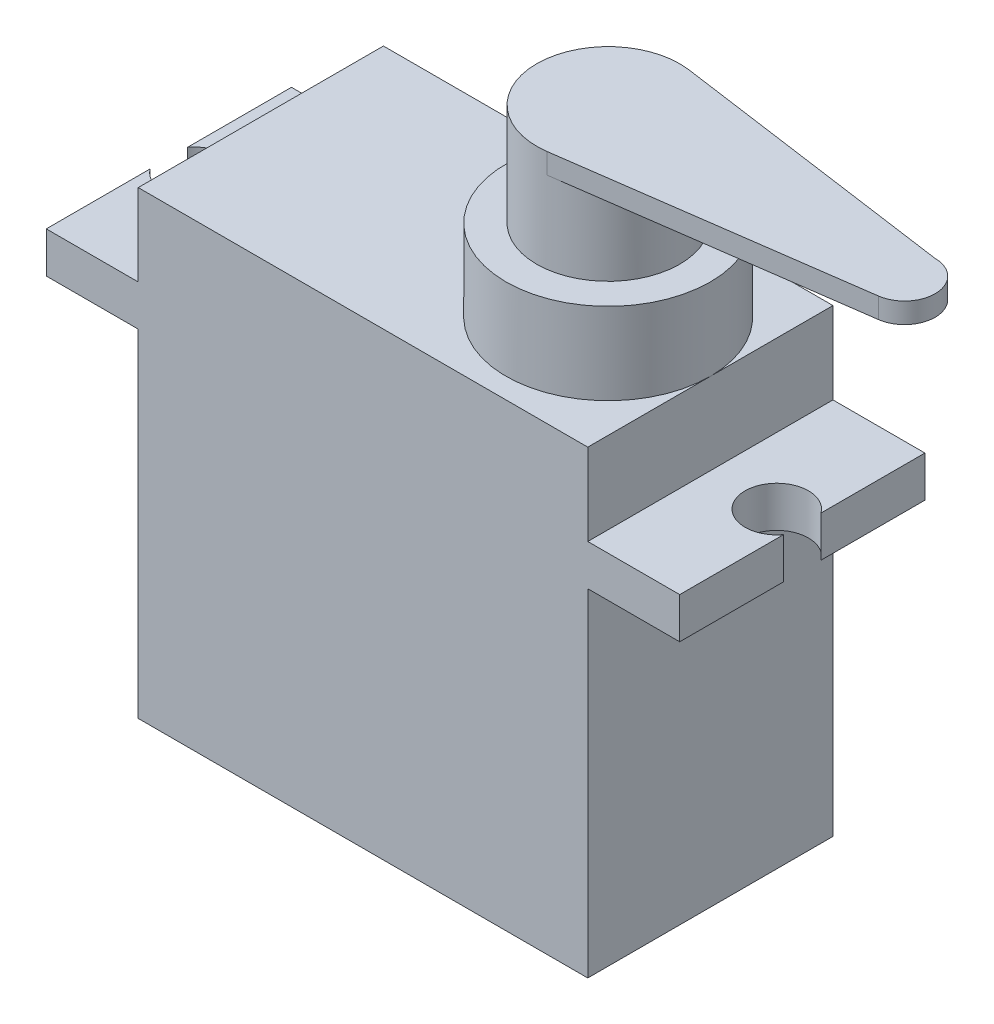
from build123d import *
from build123d.topology import SkipClean

# Parameters (mm, degrees)
SKETCH1_W           = 22
SKETCH1_H           = 12
BOSS_EXTRUDE1_DEPTH = 16.5
BOSS_EXTRUDE2_DEPTH = 2
SKETCH4_W           = 22
SKETCH4_H           = 12
BOSS_EXTRUDE3_DEPTH = 4
SKETCH5_R           = 5
BOSS_EXTRUDE4_DEPTH = 4
SKETCH7_R           = 3.5
BOSS_EXTRUDE5_DEPTH = 4
BOSS_EXTRUDE6_DEPTH = 1
CUT_EXTRUDE2_REACH  = 40.888


with BuildPart() as part:
    # Sketch1 → Boss-Extrude1 (new body)
    with BuildSketch(Plane(origin=(0, 0, 0), x_dir=(1, 0, 0), z_dir=(0, 1, 0))):
        Rectangle(SKETCH1_W, SKETCH1_H)
    extrude(amount=BOSS_EXTRUDE1_DEPTH)

    # Sketch2 → Boss-Extrude2 (add)
    with BuildSketch(Plane(origin=(0, 16.5, 0), x_dir=(1, 0, 0), z_dir=(0, 1, 0))):
        with BuildLine():
            Line((-15.5, 6), (15.5, 6))
            Line((15.5, 6), (15.5, 0.916515))
            ThreePointArc((15.5, 0.916515), (12.7, 0), (15.5, -0.916515))
            Line((15.5, -0.916515), (15.5, -6))
            Line((15.5, -6), (-15.5, -6))
            Line((-15.5, -6), (-15.5, -0.916515))
            ThreePointArc((-15.5, -0.916515), (-12.7, 0), (-15.5, 0.916515))
            Line((-15.5, 0.916515), (-15.5, 6))
        make_face()
    extrude(amount=BOSS_EXTRUDE2_DEPTH)

    # Sketch4 → Boss-Extrude3 (add)
    with BuildSketch(Plane(origin=(0, 18.5, 0), x_dir=(1, 0, 0), z_dir=(0, 1, 0))):
        Rectangle(SKETCH4_W, SKETCH4_H)
    extrude(amount=BOSS_EXTRUDE3_DEPTH)

    # Sketch5 → Boss-Extrude4 (add)
    with BuildSketch(Plane(origin=(0, 22.5, 0), x_dir=(1, 0, 0), z_dir=(0, 1, 0))):
        with Locations((6, 0)):
            Circle(SKETCH5_R)
    extrude(amount=BOSS_EXTRUDE4_DEPTH)

    # Sketch7 → Boss-Extrude5 (add)
    with BuildSketch(Plane(origin=(0, 26.5, 0), x_dir=(1, 0, 0), z_dir=(0, 1, 0))):
        with Locations(Location((6, 0, 0), (0, 0, 270))):
            Circle(SKETCH7_R)
    extrude(amount=BOSS_EXTRUDE5_DEPTH)

    # Sketch8 → Boss-Extrude6 (add)
    with SkipClean():  # the faces are left unmerged after this step: merging them gives an invalid solid
        with BuildSketch(Plane(origin=(0, 30.5, 0), x_dir=(1, 0, 0), z_dir=(0, 1, 0))):
            with BuildLine():
                Line((5.516407, -3.46643), (-8.710709, -1.481642))
                ThreePointArc((-8.710709, -1.481642), (-9.996409, 0.103599), (-8.504009, 1.495991))
                Line((-8.504009, 1.495991), (5.512894, 3.465938))
                ThreePointArc((5.512894, 3.465938), (6, 3.5), (6.487106, 3.465938))
                Line((6.487106, 3.465938), (20.504009, 1.495991))
                ThreePointArc((20.504009, 1.495991), (21.996409, 0.103599), (20.710709, -1.481642))
                Line((20.710709, -1.481642), (6.483593, -3.46643))
                ThreePointArc((6.483593, -3.46643), (6, -3.5), (5.516407, -3.46643))
            make_face()
        extrude(amount=BOSS_EXTRUDE6_DEPTH)

    # Sketch10 → Cut-Extrude2 (cut, up to next)
    with BuildSketch(Plane(origin=(0, 31.5, 0), x_dir=(1, 0, 0), z_dir=(0, 1, 0)), mode=Mode.PRIVATE) as cut_extrude2_sk1:
        with BuildLine():
            Line((-8.710709, -1.481642), (5.516407, -3.46643))
            ThreePointArc((5.516407, -3.46643), (2.5, -0.001774), (5.512894, 3.465938))
            Line((5.512894, 3.465938), (-8.504009, 1.495991))
            ThreePointArc((-8.504009, 1.495991), (-9.996409, 0.103599), (-8.710709, -1.481642))
        make_face()
    cut_extrude2_tool1 = extrude(cut_extrude2_sk1.sketch, amount=-CUT_EXTRUDE2_REACH, mode=Mode.PRIVATE) & part.part
    add(cut_extrude2_tool1.solids().sort_by_distance((-2.43068, 31.5, 0.003848))[0], mode=Mode.SUBTRACT)


solid = part.part
